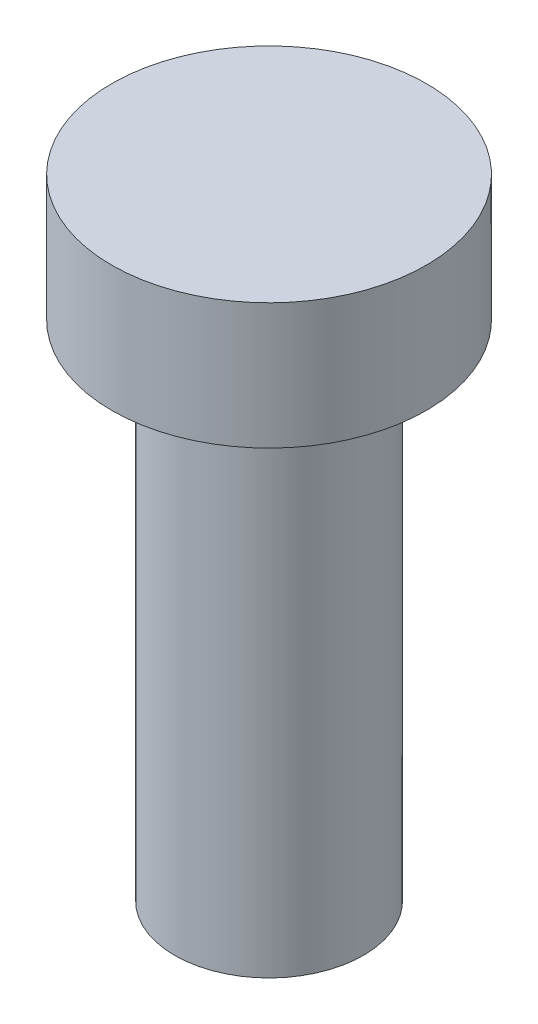
from build123d import *

# Parameters (mm, degrees)
SKETCH1_R           = 1.5
BOSS_EXTRUDE1_DEPTH = 8
SKETCH2_R           = 2.5
BOSS_EXTRUDE2_DEPTH = 2


with BuildPart() as part:
    # Sketch1 → Boss-Extrude1 (new body)
    with BuildSketch(Plane(origin=(0, 0, 0), x_dir=(1, 0, 0), z_dir=(0, 1, 0))):
        with Locations(Location((0, 0, 0), (0, 0, 270))):
            Circle(SKETCH1_R)
    extrude(amount=BOSS_EXTRUDE1_DEPTH)

    # Sketch2 → Boss-Extrude2 (add)
    with BuildSketch(Plane(origin=(0, 8, 0), x_dir=(1, 0, 0), z_dir=(0, 1, 0))):
        with Locations(Location((0, 0, 0), (0, 0, 270))):
            Circle(SKETCH2_R)
    extrude(amount=BOSS_EXTRUDE2_DEPTH)


solid = part.part
